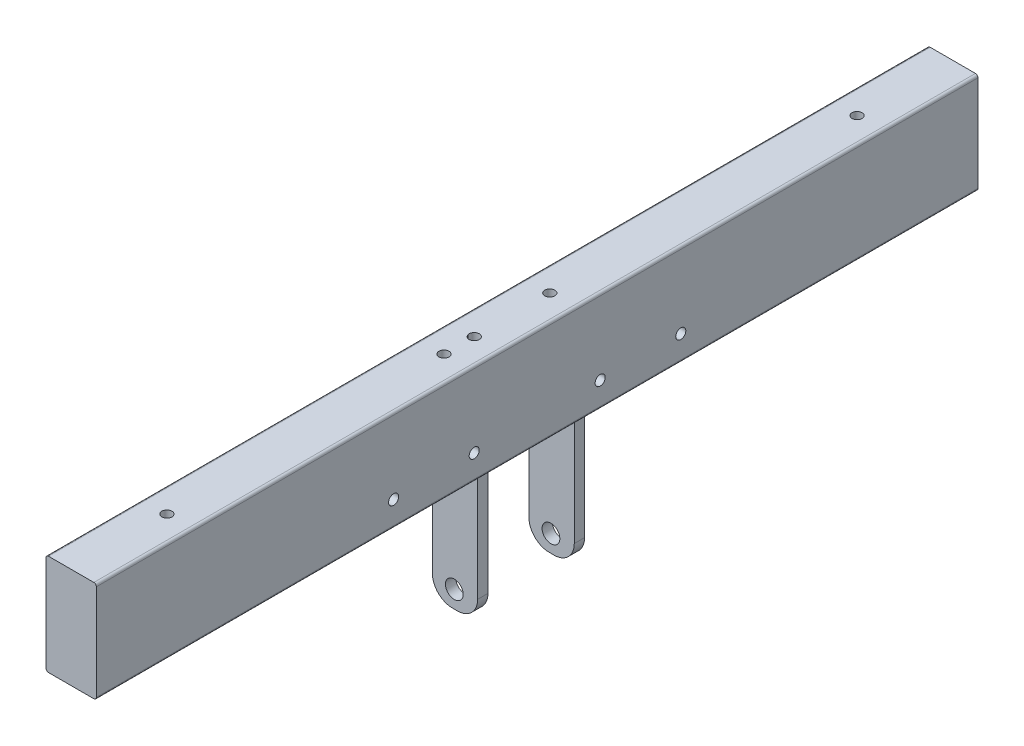
from build123d import *

# Parameters (mm, degrees)
SKETCH_1_W          = 20
SKETCH_1_H          = 40
EXTRUDE_1_DEPTH     = 350
FILLET_1_R          = 1
SKETCH_2_R          = 2
CUT_EXTRUDE_1_DEPTH = 310
SKETCH_3_R          = 2
CUT_EXTRUDE_2_DEPTH = 90
SKETCH_4_W          = 18
SKETCH_4_H          = 4.110313015
EXTRUDE_2_DEPTH     = 50
SKETCH_5_R          = 3.525335322
CUT_EXTRUDE_3_DEPTH = 50
FILLET_2_R          = 8


with BuildPart() as part:
    # 草图1 → 凸台-拉伸1 (new body)
    with BuildSketch(Plane.XY):
        with Locations((10, 20)):
            Rectangle(SKETCH_1_W, SKETCH_1_H)
    extrude(amount=EXTRUDE_1_DEPTH)

    # 圆角1
    fillet_1_edges = [part.edges().sort_by_distance(p)[0] for p in [
        (0, 40, 175),
        (20, 40, 175),
        (20, 0, 175),
        (0, 0, 175),
    ]]
    fillet(fillet_1_edges, radius=FILLET_1_R)

    # 草图2 → 切除-拉伸1 (cut)
    with BuildSketch(Plane.ZY):
        with Locations((118, 10)):
            Circle(SKETCH_2_R)
        with Locations((232, 10)):
            Circle(SKETCH_2_R)
        with Locations((150, 10)):
            Circle(SKETCH_2_R)
        with Locations((200, 10)):
            Circle(SKETCH_2_R)
    extrude(amount=-CUT_EXTRUDE_1_DEPTH, mode=Mode.SUBTRACT)

    # 草图3 → 切除-拉伸2 (cut)
    with BuildSketch(Plane(origin=(0, 40, 0), x_dir=(1, 0, 0), z_dir=(0, 1, 0))):
        with Locations(Location((10, -38, 0), (0, 0, 270))):
            Circle(SKETCH_3_R)
        with Locations(Location((10, -312, 0), (0, 0, 270))):
            Circle(SKETCH_3_R)
        with Locations(Location((10, -160, 0), (0, 0, 270))):
            Circle(SKETCH_3_R)
        with Locations(Location((10, -190, 0), (0, 0, 270))):
            Circle(SKETCH_3_R)
        with Locations(Location((10, -202, 0), (0, 0, 270))):
            Circle(SKETCH_3_R)
    extrude(amount=-CUT_EXTRUDE_2_DEPTH, mode=Mode.SUBTRACT)

    # 草图4 → 凸台-拉伸2 (add)
    with BuildSketch(Plane.XZ):
        with Locations((10, 195.586566354)):
            Rectangle(SKETCH_4_W, SKETCH_4_H)
        with Locations((10, 157.223644883)):
            Rectangle(SKETCH_4_W, SKETCH_4_H)
    extrude(amount=EXTRUDE_2_DEPTH)

    # 草图5 → 切除-拉伸3 (cut)
    with BuildSketch(Plane(origin=(0, 0, 155.168488375), x_dir=(-1, 0, 0), z_dir=(0, 0, -1))):
        with Locations((-9.743882415, -43.170339686)):
            Circle(SKETCH_5_R)
    extrude(amount=-CUT_EXTRUDE_3_DEPTH, mode=Mode.SUBTRACT)

    # 圆角2
    fillet_2_edges = [part.edges().sort_by_distance(p)[0] for p in [
        (1, -50, 157.223644882),
        (19, -50, 157.223644882),
        (1, -50, 195.586566354),
        (19, -50, 195.586566354),
    ]]
    fillet(fillet_2_edges, radius=FILLET_2_R)


solid = part.part
